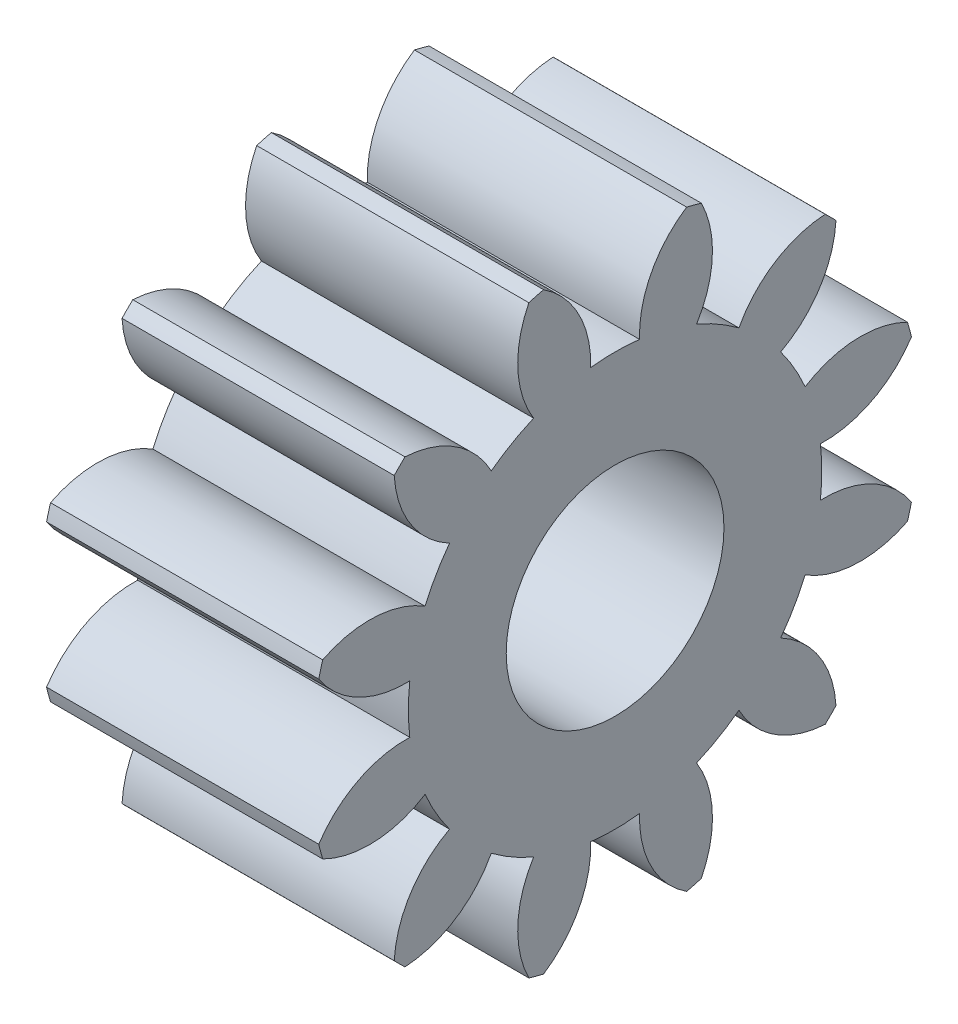
from build123d import *

# Parameters (mm, degrees)
BASPROSKE_W     = 2.5
BASPROSKE_H     = 2.8
TOOTHCUT_DEPTH  = 5.68294779
TEETHCUTS_COUNT = 12
TEETHCUTS_ANGLE = 330
BORSKE_R        = 1
BORE_DEPTH      = 50.0000508


with BuildPart() as part:
    # BasProSke → Base-Revolve (revolve)
    with BuildSketch(Plane(origin=(0, 0, 0), x_dir=(1, 0, 0), z_dir=(0, 1, 0)), mode=Mode.PRIVATE) as base_revolve_sk:
        with Locations((1.25, 1.4)):
            Rectangle(BASPROSKE_W, BASPROSKE_H)
    revolve(base_revolve_sk.sketch.rotate(Axis((-10, 0, 0), (1, 0, 0)), 180), axis=Axis((-10, 0, 0), (1, 0, 0)))

    # TooCutSke → ToothCut (cut, through all)
    with BuildSketch(Plane(origin=(0, 0, 0), x_dir=(0, 0, -1), z_dir=(1, 0, 0))):
        with BuildLine():
            ThreePointArc((0.224627026, 1.885667972), (0, 1.899), (-0.224627026, 1.885667972))
            ThreePointArc((-0.224627026, 1.885667972), (-0.339529641, 2.375971187), (-0.686817046, 2.740650927))
            ThreePointArc((-0.686817046, 2.740650927), (0, 2.8254), (0.686817046, 2.740650927))
            ThreePointArc((0.686817046, 2.740650927), (0.339529641, 2.375971187), (0.224627026, 1.885667972))
        make_face()
    toothcut = extrude(amount=TOOTHCUT_DEPTH, mode=Mode.SUBTRACT)

    # TeethCuts: ToothCut ×12 about axis
    teethcuts_axis = Axis((-10, 0, 0), (1, 0, 0))
    for i in range(1, TEETHCUTS_COUNT):
        add(toothcut.rotate(teethcuts_axis, i * TEETHCUTS_ANGLE / (TEETHCUTS_COUNT - 1)), mode=Mode.SUBTRACT)

    # BorSke → Bore (cut, symmetric)
    with BuildSketch(Plane(origin=(0, 0, 0), x_dir=(0, 0, -1), z_dir=(1, 0, 0))):
        with Locations(Location((0, 0, 0), (0, 0, 180))):
            Circle(BORSKE_R)
    extrude(amount=BORE_DEPTH, both=True, mode=Mode.SUBTRACT)


solid = part.part
